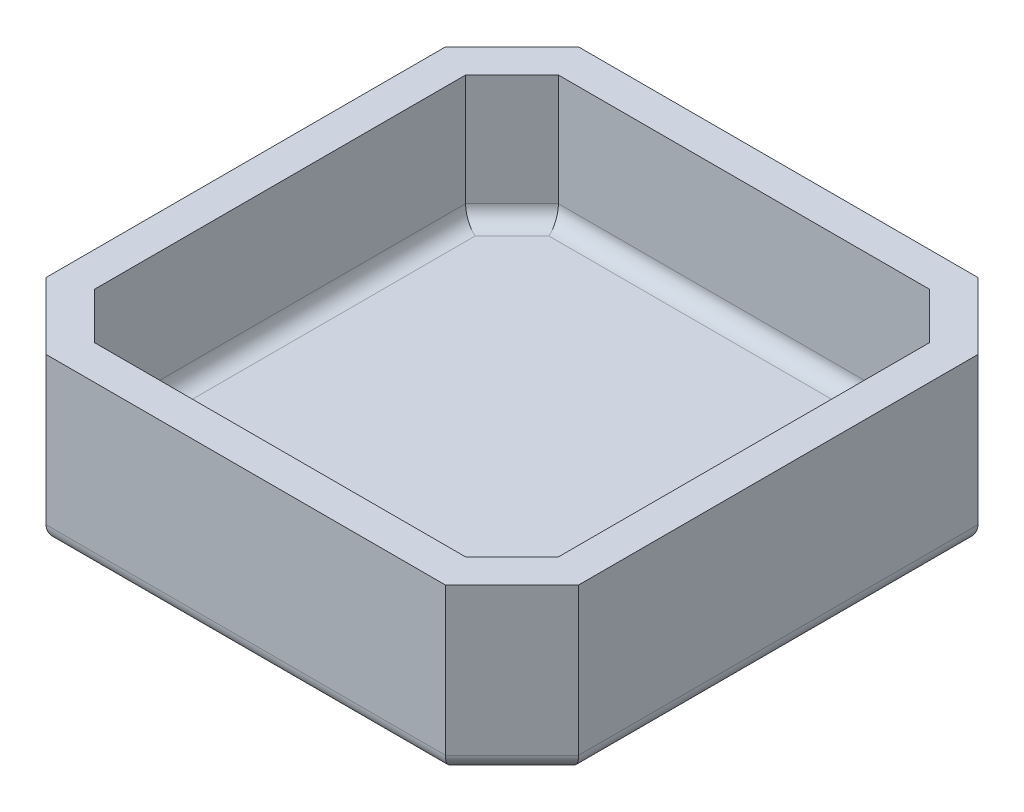
from build123d import *

# Parameters (mm, degrees)
SKETCH1_W      = 65
SKETCH1_H      = 65
EXTRUDE1_DEPTH = 4.4
CHAMFER1_SIZE  = 8.125
EXTRUDE2_DEPTH = 15.6
FILLET1_R      = 2


with BuildPart() as part:
    # Sketch1 → Extrude1 (new body)
    with BuildSketch(Plane(origin=(0, 0, 0), x_dir=(1, 0, 0), z_dir=(0, 1, 0))):
        Rectangle(SKETCH1_W, SKETCH1_H)
    extrude(amount=EXTRUDE1_DEPTH)

    # Chamfer1
    chamfer1_edges = [part.edges().sort_by_distance(p)[0] for p in [
        (32.5, 2.2, 32.5),
        (-32.5, 2.2, 32.5),
        (-32.5, 2.2, -32.5),
        (32.5, 2.2, -32.5),
    ]]
    chamfer(chamfer1_edges, length=CHAMFER1_SIZE)

    # Sketch2 → Extrude2 (add)
    with BuildSketch(Plane(origin=(0, 4.4, 0), x_dir=(1, 0, 0), z_dir=(0, 1, 0))):
        Polygon((32.5, 24.375), (24.375, 32.5), (-24.375, 32.5), (-32.5, 24.375), (-32.5, -24.375), (-24.375, -32.5), (24.375, -32.5), (32.5, -24.375), align=None)
        Polygon((-22.635303038, 28.3), (-28.3, 22.635303038), (-28.3, -22.635303038), (-22.635303038, -28.3), (15.182932057, -28.3), (22.635303038, -28.3), (28.3, -22.635303038), (28.3, 22.635303038), (22.635303038, 28.3), align=None, mode=Mode.SUBTRACT)
    extrude(amount=EXTRUDE2_DEPTH)

    # Fillet1
    fillet1_edges = [part.edges().sort_by_distance(p)[0] for p in [
        (-32.5, 0, 0),
        (32.5, 0, 0),
        (0, 0, 32.5),
        (0, 0, -32.5),
        (-28.4375, 0, 28.4375),
        (28.4375, 0, 28.4375),
        (28.4375, 0, -28.4375),
        (-28.4375, 0, -28.4375),
        (-25.467651519, 4.4, -25.467651519),
        (-28.3, 4.4, 0),
        (-25.467651519, 4.4, 25.467651519),
        (0, 4.4, 28.3),
        (25.467651519, 4.4, 25.467651519),
        (28.3, 4.4, 0),
        (25.467651519, 4.4, -25.467651519),
        (0, 4.4, -28.3),
    ]]
    fillet(fillet1_edges, radius=FILLET1_R)


solid = part.part
